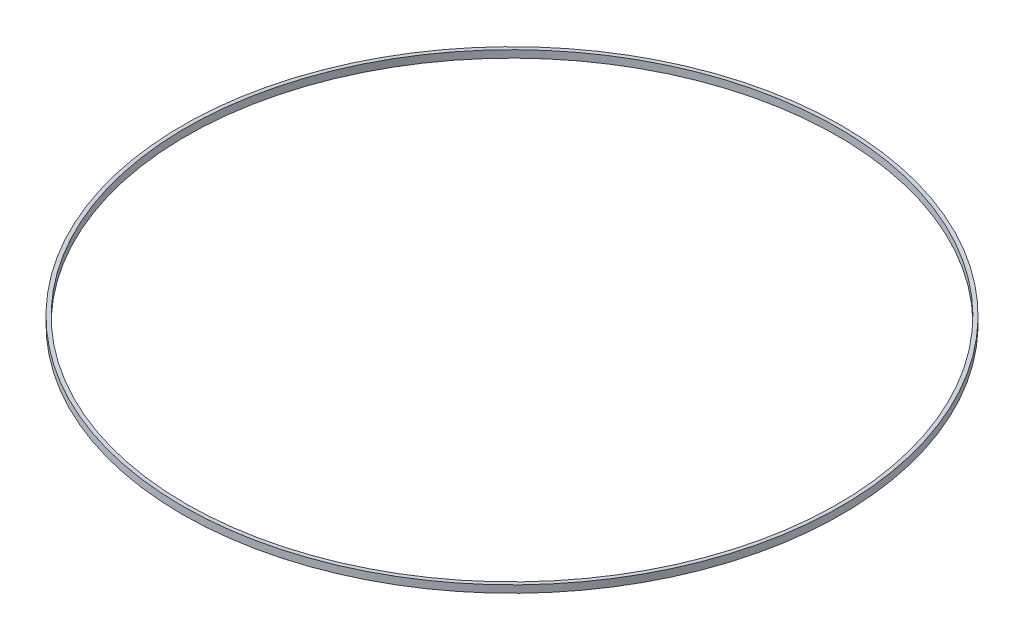
from build123d import *

# Parameters (mm, degrees)
SKETCH1_R           = 45
SKETCH1_R_2         = 44.5
BOSS_EXTRUDE1_DEPTH = 1


with BuildPart() as part:
    # Sketch1 → Boss-Extrude1 (new body)
    with BuildSketch(Plane(origin=(0, 0, 0), x_dir=(1, 0, 0), z_dir=(0, 1, 0))):
        with Locations(Location((0, 0, 0), (0, 0, 270))):
            Circle(SKETCH1_R)
        with Locations(Location((0, 0, 0), (0, 0, 270))):
            Circle(SKETCH1_R_2, mode=Mode.SUBTRACT)
    extrude(amount=BOSS_EXTRUDE1_DEPTH)


solid = part.part
